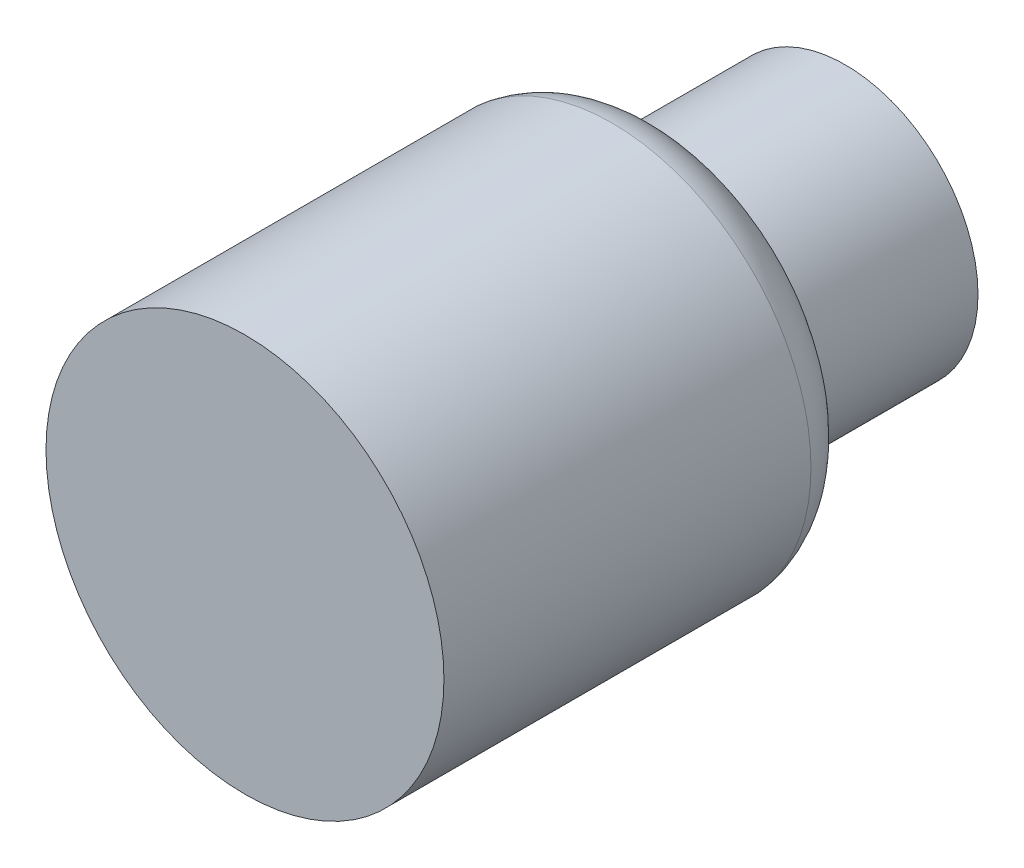
from build123d import *


with BuildPart() as part:
    # Sketch1 → Revolve1 (revolve)
    with BuildSketch(Plane(origin=(0, 0, 0), x_dir=(1, 0, 0), z_dir=(0, 1, 0)), mode=Mode.PRIVATE) as revolve1_sk:
        with BuildLine():
            Line((32.418652167, -68.5341679), (0, -68.5341679))
            Line((0, -68.5341679), (0, 29.290536607))
            Line((0, 29.290536607), (21.612434778, 29.290536607))
            Line((21.612434778, 29.290536607), (21.612434778, 0))
            ThreePointArc((21.612434778, 0), (28.745276586, -2.225650789), (32.418652167, -8.732360061))
            Line((32.418652167, -8.732360061), (32.418652167, -68.5341679))
        make_face()
    revolve(revolve1_sk.sketch.rotate(Axis((0, 0, -39.338422951), (0, 0, 1)), 180), axis=Axis((0, 0, -39.338422951), (0, 0, 1)))


solid = part.part
